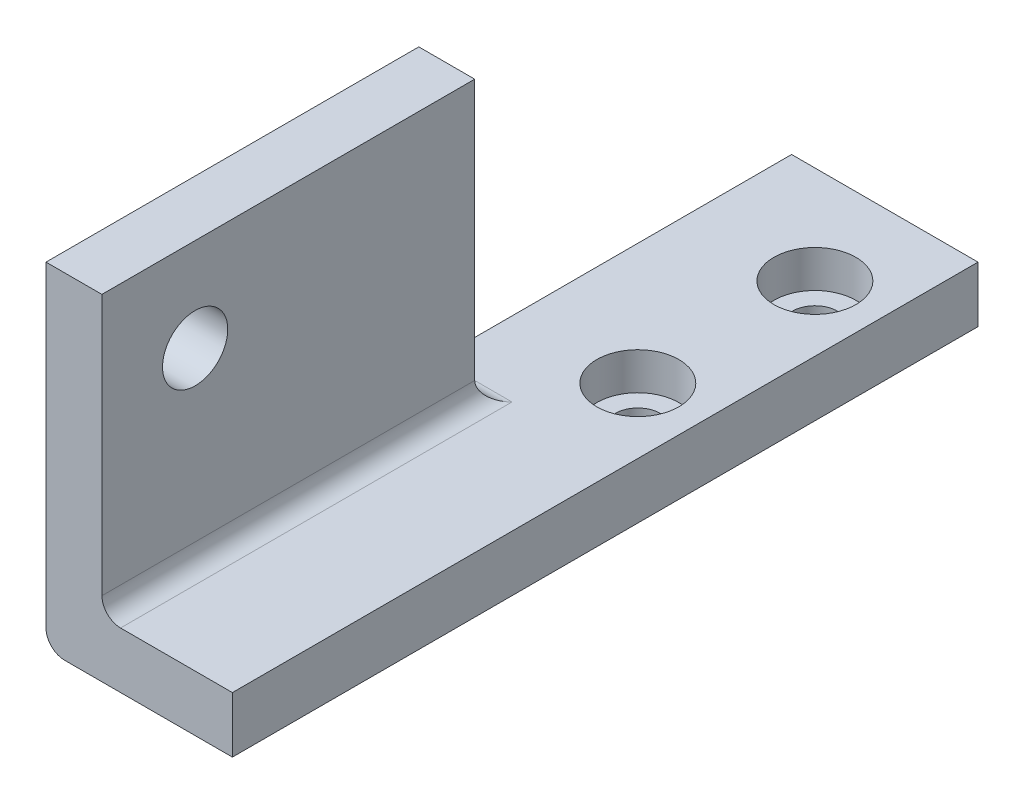
from build123d import *

# Parameters (mm, degrees)
SKETCH1_W                      = 10
SKETCH1_H                      = 20
SKETCH1_R                      = 1.175
BOSS_EXTRUDE1_DEPTH            = 3
CBORE_FOR_M2_SHCS1_D           = 2.4
CBORE_FOR_M2_SHCS1_CBORE_D     = 4.4
CBORE_FOR_M2_SHCS1_CBORE_DEPTH = 2
SKETCH6_W                      = 10
SKETCH6_H                      = 3
BOSS_EXTRUDE2_DEPTH            = 20
SKETCH8_W                      = 3
SKETCH8_H                      = 20
BOSS_EXTRUDE3_DEPTH            = 15
SKETCH9_R                      = 1.75
CUT_EXTRUDE1_DEPTH             = 28.802877549
FILLET1_R                      = 1
FILLET2_R                      = 1


with BuildPart() as part:
    # Sketch1 → Boss-Extrude1 (new body)
    with BuildSketch(Plane(origin=(0, 0, 0), x_dir=(1, 0, 0), z_dir=(0, 1, 0))):
        with Locations((5, 10)):
            Rectangle(SKETCH1_W, SKETCH1_H)
        with Locations(Location((6.5, 5.25, 0), (0, 0, 270))):
            Circle(SKETCH1_R, mode=Mode.SUBTRACT)
        with Locations(Location((6.5, 14.75, 0), (0, 0, 270))):
            Circle(SKETCH1_R, mode=Mode.SUBTRACT)
    extrude(amount=BOSS_EXTRUDE1_DEPTH)

    # CBORE for M2 SHCS1 (through all)
    with Locations(Plane(origin=(0, 3, 0), x_dir=(1, 0, 0), z_dir=(0, 1, 0))):
        with Locations((6.5, 14.75), (6.5, 5.25)):
            CounterBoreHole(CBORE_FOR_M2_SHCS1_D / 2, CBORE_FOR_M2_SHCS1_CBORE_D / 2, CBORE_FOR_M2_SHCS1_CBORE_DEPTH)

    # Sketch6 → Boss-Extrude2 (add)
    with BuildSketch(Plane(origin=(0, 0, 0), x_dir=(-1, 0, 0), z_dir=(0, 0, -1))):
        with Locations((-5, 1.5)):
            Rectangle(SKETCH6_W, SKETCH6_H)
    extrude(amount=-BOSS_EXTRUDE2_DEPTH)

    # Sketch8 → Boss-Extrude3 (add)
    with BuildSketch(Plane(origin=(0, 3, 0), x_dir=(1, 0, 0), z_dir=(0, 1, 0))):
        with Locations((1.5, -10)):
            Rectangle(SKETCH8_W, SKETCH8_H)
    extrude(amount=BOSS_EXTRUDE3_DEPTH)

    # Sketch9 → Cut-Extrude1 (cut, through all)
    with BuildSketch(Plane(origin=(3, 0, 0), x_dir=(0, 0, -1), z_dir=(1, 0, 0))):
        with Locations((-15, 13)):
            Circle(SKETCH9_R)
    extrude(amount=-CUT_EXTRUDE1_DEPTH, mode=Mode.SUBTRACT)

    # Fillet1
    fillet1_edges = [part.edges().sort_by_distance(p)[0] for p in [
        (3, 3, 10),
        (1.5, 3, 0),
    ]]
    fillet(fillet1_edges, radius=FILLET1_R)

    # Fillet2
    fillet2_edges = [part.edges().sort_by_distance(p)[0] for p in [
        (0, 0, 0),
    ]]
    fillet(fillet2_edges, radius=FILLET2_R)


solid = part.part
